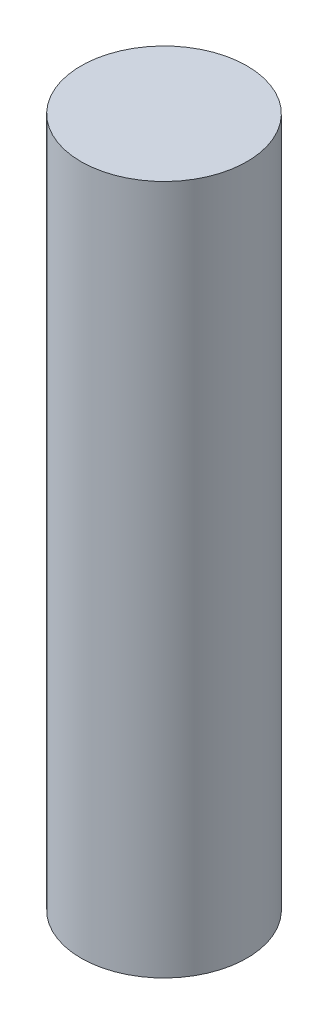
from build123d import *

# Parameters (mm, degrees)
SKETCH2_R           = 3.85
BOSS_EXTRUDE1_DEPTH = 16


with BuildPart() as part:
    # Sketch2 → Boss-Extrude1 (new, symmetric)
    with BuildSketch(Plane(origin=(0, 0, 0), x_dir=(1, 0, 0), z_dir=(0, 1, 0))):
        with Locations(Location((0, 0, 0), (0, 0, 270))):
            Circle(SKETCH2_R)
    extrude(amount=BOSS_EXTRUDE1_DEPTH, both=True)


solid = part.part
